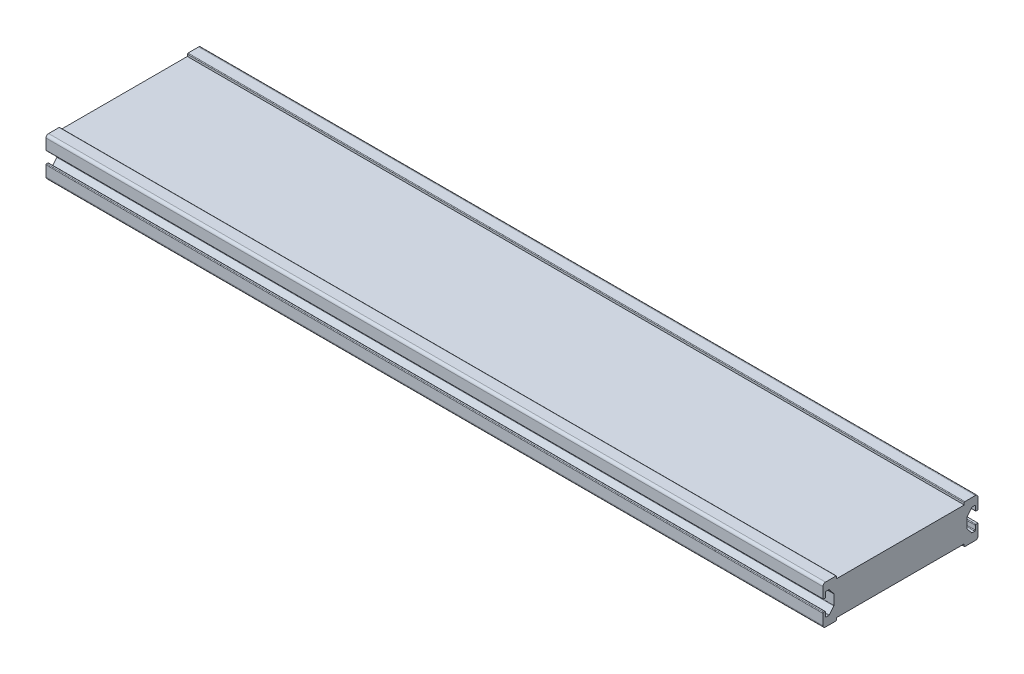
from build123d import *

# Parameters (mm, degrees)
SKETCH1_W           = 598.4875
SKETCH1_H           = 30
BOSS_EXTRUDE1_DEPTH = 119.5
FILLET1_R           = 2
CUT_EXTRUDE1_REACH  = 613.038
FILLET2_R           = 0.5
CUT_EXTRUDE2_REACH  = 613.038
SKETCH3_W           = 98.3
SKETCH3_H           = 2.02
FILLET3_R           = 0.5


with BuildPart() as part:
    # Sketch1 → Boss-Extrude1 (new body)
    with BuildSketch(Plane.XY):
        with Locations((299.24375, 15)):
            Rectangle(SKETCH1_W, SKETCH1_H)
    extrude(amount=BOSS_EXTRUDE1_DEPTH)

    # Fillet1
    fillet1_edges = [part.edges().sort_by_distance(p)[0] for p in [
        (299.24375, 0, 119.5),
        (299.24375, 0, 0),
        (299.24375, 30, 0),
        (299.24375, 30, 119.5),
    ]]
    fillet(fillet1_edges, radius=FILLET1_R)

    # Sketch2 → Cut-Extrude1 (cut, up to next)
    with BuildSketch(Plane(origin=(598.4875, 0, 0), x_dir=(0, 0, -1), z_dir=(1, 0, 0)), mode=Mode.PRIVATE) as cut_extrude1_sk1:
        with BuildLine():
            Line((-119.5, 19.4), (-119.5, 10.6))
            Line((-119.5, 10.6), (-117.978098197, 10.6))
            ThreePointArc((-117.978098197, 10.6), (-117.624544806, 10.453553391), (-117.478098197, 10.1))
            Line((-117.478098197, 10.1), (-117.478098197, 6.87))
            ThreePointArc((-117.478098197, 6.87), (-117.331651588, 6.516446609), (-116.978098197, 6.37))
            Line((-116.978098197, 6.37), (-114.998098197, 6.37))
            ThreePointArc((-114.998098197, 6.37), (-114.783369216, 6.418456575), (-114.610260359, 6.554434141))
            Line((-114.610260359, 6.554434141), (-111.107479321, 10.859434141))
            ThreePointArc((-111.107479321, 10.859434141), (-111.024191423, 11.0075469), (-110.995317159, 11.175))
            Line((-110.995317159, 11.175), (-110.995317159, 18.825))
            ThreePointArc((-110.995317159, 18.825), (-111.024191423, 18.9924531), (-111.107479321, 19.140565859))
            Line((-111.107479321, 19.140565859), (-114.610260359, 23.445565859))
            ThreePointArc((-114.610260359, 23.445565859), (-114.783369216, 23.581543425), (-114.998098197, 23.63))
            Line((-114.998098197, 23.63), (-116.978098197, 23.63))
            ThreePointArc((-116.978098197, 23.63), (-117.331651588, 23.483553391), (-117.478098197, 23.13))
            Line((-117.478098197, 23.13), (-117.478098197, 19.9))
            ThreePointArc((-117.478098197, 19.9), (-117.624544806, 19.546446609), (-117.978098197, 19.4))
            Line((-117.978098197, 19.4), (-119.5, 19.4))
        make_face()
    cut_extrude1_tool1 = extrude(cut_extrude1_sk1.sketch, amount=-CUT_EXTRUDE1_REACH, mode=Mode.PRIVATE) & part.part
    cut_extrude1 = cut_extrude1_tool1.solids().sort_by_distance((598.4875, 15, 115.219459))[0]
    add(cut_extrude1, mode=Mode.SUBTRACT)

    # Mirror1: Cut-Extrude1 across plane
    add(cut_extrude1.mirror(Plane(origin=(0, 0, 59.75), x_dir=(1, 0, 0), z_dir=(0, 0, -1))), mode=Mode.SUBTRACT)

    # Fillet2
    fillet2_edges = [part.edges().sort_by_distance(p)[0] for p in [
        (299.24375, 10.6, 119.5),
        (299.24375, 19.4, 119.5),
    ]]
    fillet(fillet2_edges, radius=FILLET2_R)

    # Sketch3 → Cut-Extrude2 (cut, up to next)
    with BuildSketch(Plane(origin=(598.4875, 0, 0), x_dir=(0, 0, -1), z_dir=(1, 0, 0)), mode=Mode.PRIVATE) as cut_extrude2_sk1:
        with Locations((-59.75, 28.99)):
            Rectangle(SKETCH3_W, SKETCH3_H)
    cut_extrude2_tool1 = extrude(cut_extrude2_sk1.sketch, amount=-CUT_EXTRUDE2_REACH, mode=Mode.PRIVATE) & part.part
    cut_extrude2 = cut_extrude2_tool1.solids().sort_by_distance((598.4875, 28.99, 59.75))[0]
    add(cut_extrude2, mode=Mode.SUBTRACT)

    # Mirror2: Cut-Extrude2 across plane
    add(cut_extrude2.mirror(Plane.ZX.offset(15)), mode=Mode.SUBTRACT)

    # Fillet3
    fillet3_edges = [part.edges().sort_by_distance(p)[0] for p in [
        (299.24375, 30, 108.9),
        (299.24375, 30, 10.6),
        (299.24375, 0, 108.9),
        (299.24375, 0, 10.6),
    ]]
    fillet(fillet3_edges, radius=FILLET3_R)


solid = part.part
